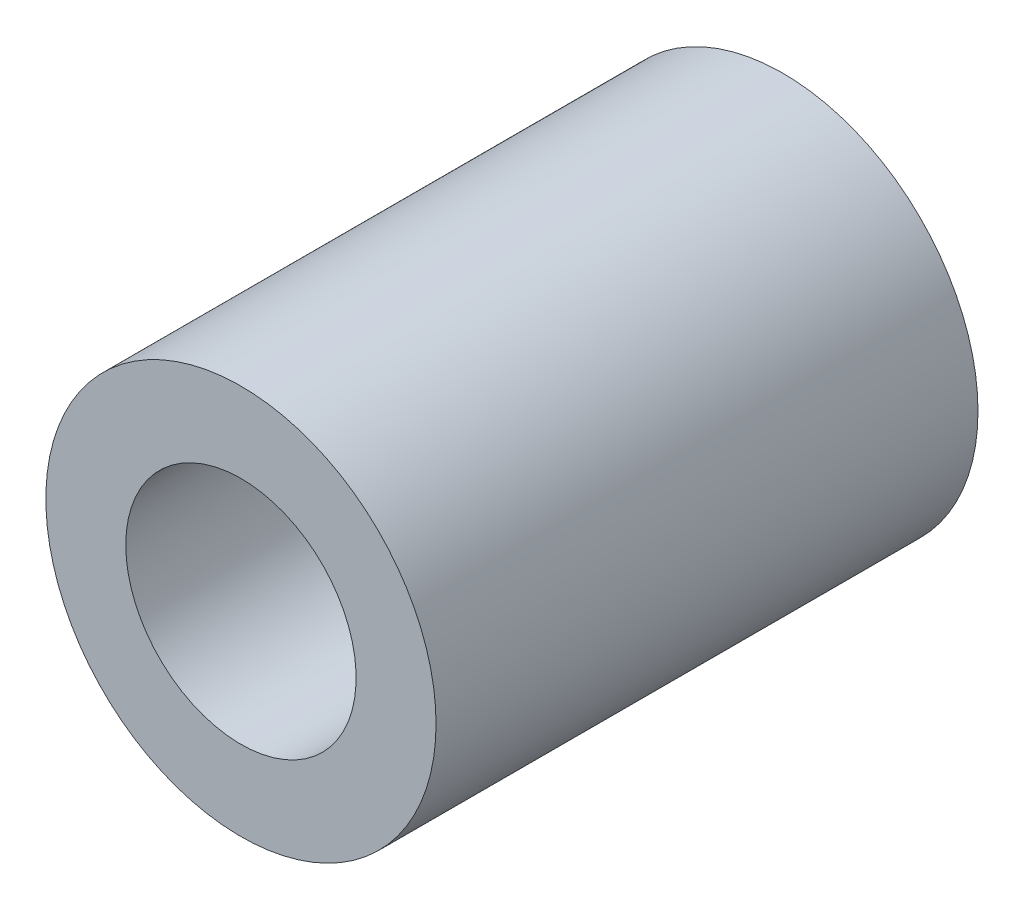
from build123d import *

# Parameters (mm, degrees)
SKETCH1_R           = 3.6
BOSS_EXTRUDE1_DEPTH = 10
SKETCH2_R           = 2.125
CUT_EXTRUDE1_DEPTH  = 12.221408111


with BuildPart() as part:
    # Sketch1 → Boss-Extrude1 (new body)
    with BuildSketch(Plane.XY):
        Circle(SKETCH1_R)
    extrude(amount=BOSS_EXTRUDE1_DEPTH)

    # Sketch2 → Cut-Extrude1 (cut, through all)
    with BuildSketch(Plane(origin=(0, 0, 0), x_dir=(-1, 0, 0), z_dir=(0, 0, -1))):
        Circle(SKETCH2_R)
    extrude(amount=-CUT_EXTRUDE1_DEPTH, mode=Mode.SUBTRACT)


solid = part.part
